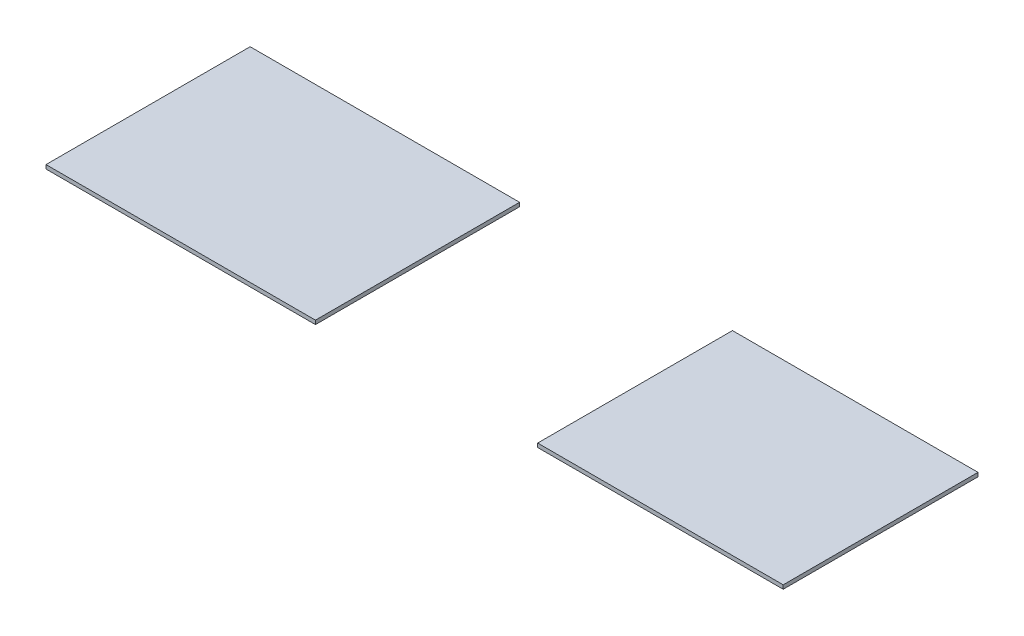
from build123d import *

# Parameters (mm, degrees)
SKETCH1_W             = 401.139240224
SKETCH1_H             = 318.243482743
BOSS_EXTRUDE1_DEPTH   = 6.35
SKETCH1_W_2           = 440.205056968
SKETCH1_H_2           = 333.488679521
BOSS_EXTRUDE1_2_DEPTH = 6.35


with BuildPart() as part:
    # Sketch1 → Boss-Extrude1 (new body)
    with BuildSketch(Plane(origin=(0, 0, 0), x_dir=(1, 0, 0), z_dir=(0, 1, 0))):
        with Locations((318.96934742, 136.253946205)):
            Rectangle(SKETCH1_W, SKETCH1_H)
    extrude(amount=BOSS_EXTRUDE1_DEPTH)


with BuildPart() as body_2:
    # Sketch1 → Boss-Extrude1 2 (new body)
    with BuildSketch(Plane(origin=(0, 0, 0), x_dir=(1, 0, 0), z_dir=(0, 1, 0))):
        with Locations((-457.106451065, 136.253946205)):
            Rectangle(SKETCH1_W_2, SKETCH1_H_2)
    extrude(amount=BOSS_EXTRUDE1_2_DEPTH)


solid = Compound([part.part, body_2.part])
